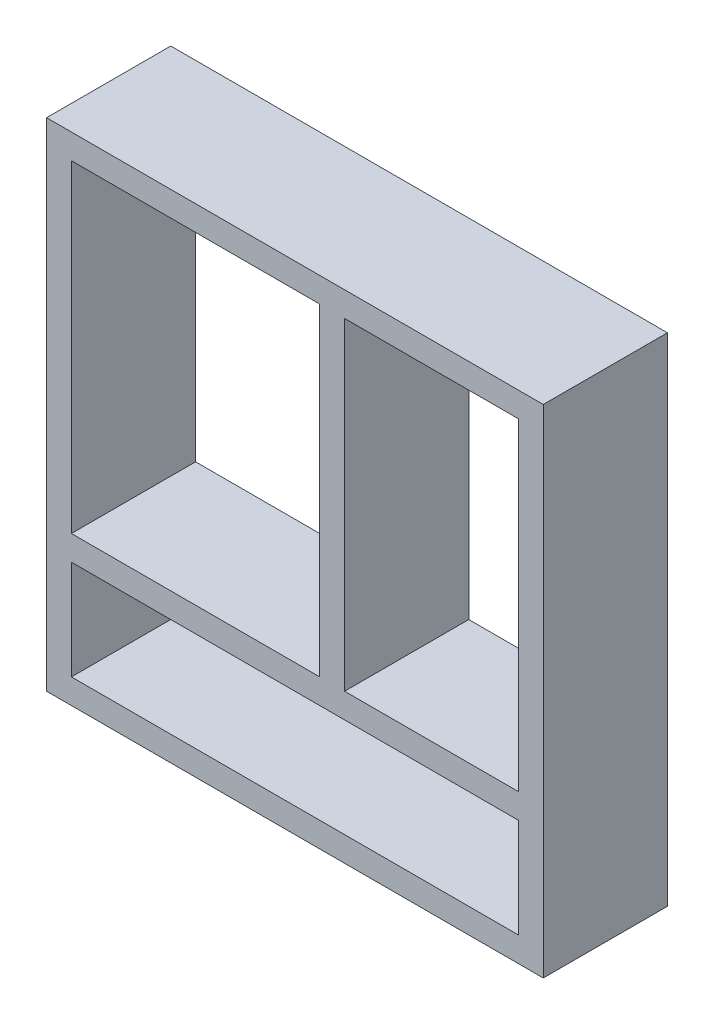
from build123d import *

# Parameters (mm, degrees)
SKETCH1_W           = 10
SKETCH1_H           = 40
SKETCH1_H_2         = 10
SKETCH1_W_2         = 180
SKETCH1_W_3         = 200
SKETCH1_H_3         = 150
SKETCH1_W_4         = 100
SKETCH1_H_4         = 130
SKETCH1_W_5         = 70
BOSS_EXTRUDE1_DEPTH = 50


with BuildPart() as part:
    # Sketch1 → Boss-Extrude1 (new body)
    # profile 1 of 6: a face of its own
    with BuildSketch(Plane.XY):
        with Locations((-95, -95)):
            Rectangle(SKETCH1_W, SKETCH1_H)
    # profile 2 of 6: a face of its own
    with BuildSketch(Plane.XY):
        with Locations((-95, -120)):
            Rectangle(SKETCH1_W, SKETCH1_H_2)
    # profile 3 of 6: a face of its own
    with BuildSketch(Plane.XY):
        with Locations((0, -120)):
            Rectangle(SKETCH1_W_2, SKETCH1_H_2)
    # profile 4 of 6: a face of its own
    with BuildSketch(Plane.XY):
        with Locations((95, -120)):
            Rectangle(SKETCH1_W, SKETCH1_H_2)
    # profile 5 of 6: a face of its own
    with BuildSketch(Plane.XY):
        with Locations((95, -95)):
            Rectangle(SKETCH1_W, SKETCH1_H)
    # profile 6 of 6: a face of its own
    with BuildSketch(Plane.XY):
        Rectangle(SKETCH1_W_3, SKETCH1_H_3)
        with Locations((-40, 0)):
            Rectangle(SKETCH1_W_4, SKETCH1_H_4, mode=Mode.SUBTRACT)
        with Locations((55, 0)):
            Rectangle(SKETCH1_W_5, SKETCH1_H_4, mode=Mode.SUBTRACT)
    extrude(amount=BOSS_EXTRUDE1_DEPTH)


solid = part.part
